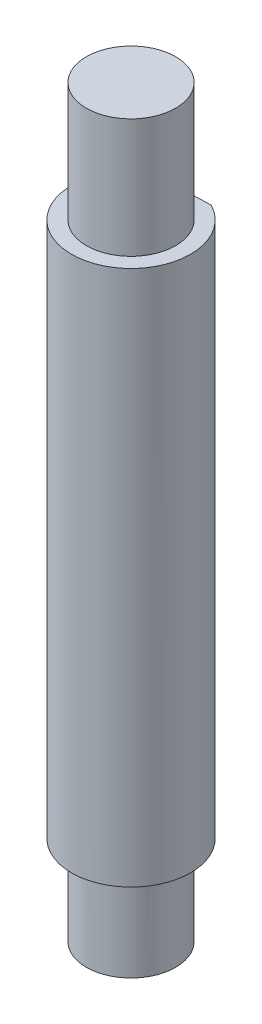
from build123d import *

# Parameters (mm, degrees)
SKETCH_1_R      = 1.5
EXTRUDE_1_DEPTH = 25
EXTRUDE_START   = 15
SKETCH_2_R      = 2
SKETCH_2_R_2    = 1.5
EXTRUDE_2_DEPTH = 15
SKETCH_3_R      = 1.5
EXTRUDE_3_DEPTH = 3


with BuildPart() as part:
    # 草图1 → 凸台-拉伸1 (new body)
    with BuildSketch(Plane(origin=(0, 0, 0), x_dir=(1, 0, 0), z_dir=(0, 1, 0))):
        with Locations(Location((0, 0, 0), (0, 0, 270))):
            Circle(SKETCH_1_R)
    extrude(amount=EXTRUDE_1_DEPTH)

    # 草图2 → 凸台-拉伸2 (add)
    with BuildSketch(Plane(origin=(0, 18, 0), x_dir=(-1, 0, 0), z_dir=(0, -1, 0)).offset(EXTRUDE_START)):
        with Locations(Location((0, 0, 0), (0, 0, 90))):
            Circle(SKETCH_2_R)
        with Locations(Location((0, 0, 0), (0, 0, 90))):
            Circle(SKETCH_2_R_2, mode=Mode.SUBTRACT)
    extrude(amount=-EXTRUDE_2_DEPTH)

    # 草图3 → 凸台-拉伸3 (add)
    with BuildSketch(Plane(origin=(0, 18, 0), x_dir=(1, 0, 0), z_dir=(0, 1, 0))):
        with BuildLine():
            Line((0.91625301, 1.777774007), (-1.022249701, 1.719012958))
            ThreePointArc((-1.022249701, 1.719012958), (0.060597358, -1.999081779), (0.91625301, 1.777774007))
        make_face()
        with Locations(Location((0, 0, 0), (0, 0, 90))):
            Circle(SKETCH_3_R, mode=Mode.SUBTRACT)
    extrude(amount=EXTRUDE_3_DEPTH)


solid = part.part
